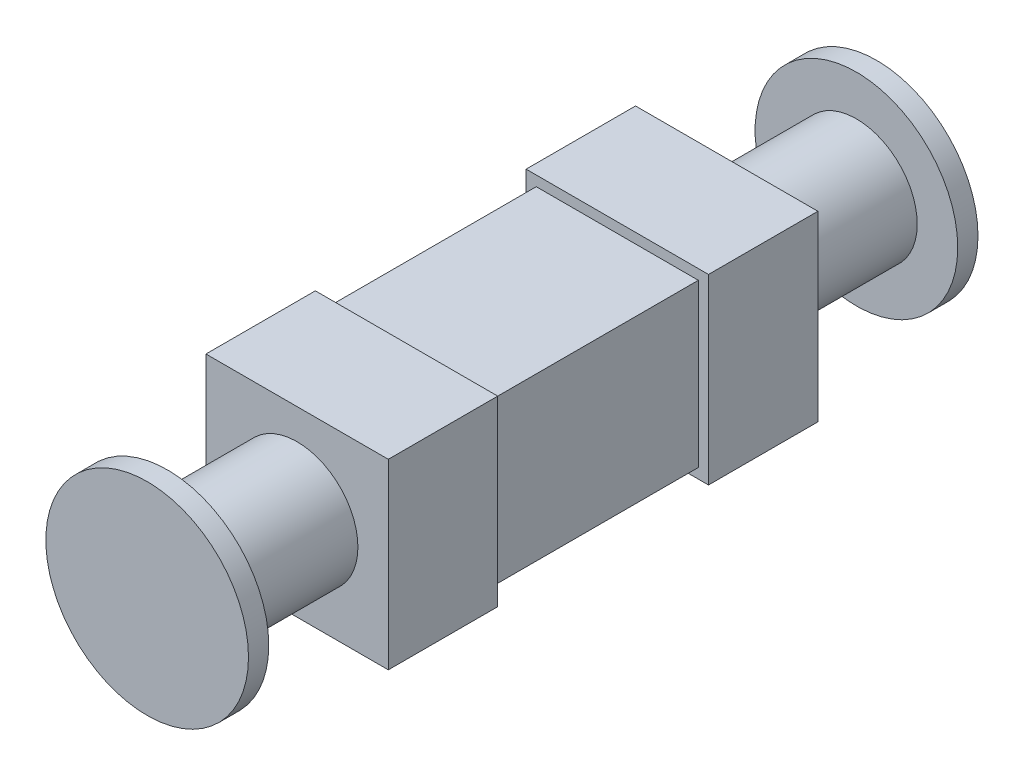
from build123d import *

# Parameters (mm, degrees)
SKETCH2_W           = 4
SKETCH2_H           = 4
BOSS_EXTRUDE1_DEPTH = 10.6
SKETCH4_W           = 4.5
SKETCH4_H           = 4.5
BOSS_EXTRUDE3_DEPTH = 2.7


with BuildPart() as part:
    # Sketch1 → Revolve1 (revolve)
    with BuildSketch(Plane(origin=(0, 0, 0), x_dir=(0, 0, -1), z_dir=(1, 0, 0)), mode=Mode.PRIVATE) as revolve1_sk:
        Polygon((-9, 0), (9, 0), (9, 2.5), (8.5, 2.5), (8.5, 1.5), (5.3, 1.5), (5.3, 2), (-5.3, 2), (-5.3, 1.5), (-8.5, 1.5), (-8.5, 2.5), (-9, 2.5), align=None)
    revolve(revolve1_sk.sketch.rotate(Axis((0, 0, 9), (0, 0, -1)), 90), axis=Axis((0, 0, 9), (0, 0, -1)))

    # Sketch2 → Boss-Extrude1 (add)
    with BuildSketch(Plane.XY.offset(5.3)):
        Rectangle(SKETCH2_W, SKETCH2_H)
    extrude(amount=-BOSS_EXTRUDE1_DEPTH)

    # Sketch4 → Boss-Extrude3 (add)
    with BuildSketch(Plane.XY.offset(5.3)):
        Rectangle(SKETCH4_W, SKETCH4_H)
    boss_extrude3 = extrude(amount=-BOSS_EXTRUDE3_DEPTH)

    # Mirror1: Boss-Extrude3 across plane
    add(boss_extrude3.mirror(Plane.XY))


solid = part.part
